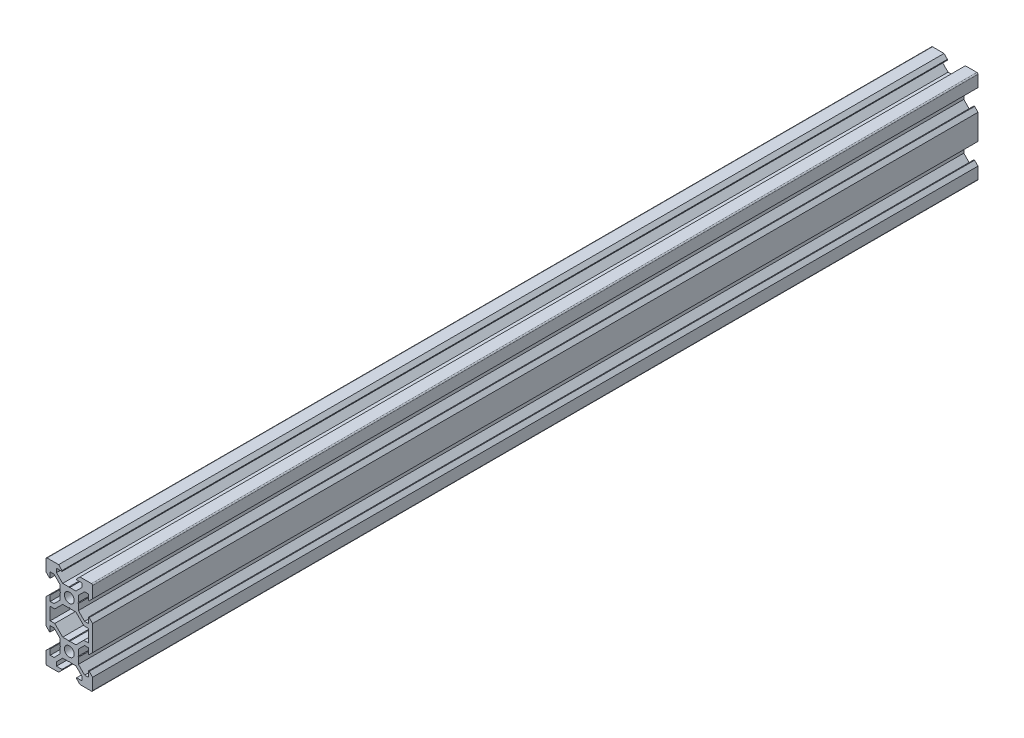
from build123d import *
from build123d.topology import SkipClean

# Parameters (mm, degrees)
BOSS_EXTRU_1_DEPTH     = 380
SYM_TRIE6_COPY_1_DEPTH = 380


with BuildPart() as part:
    # Esquisse1 → Boss.-Extru.1 (new body)
    with BuildSketch(Plane.XY):
        with BuildLine():
            Line((-9.5, 10), (-4.58, 10))
            Line((-4.58, 10), (-3.125, 8.545))
            Line((-3.125, 8.545), (-3.125, 8.2))
            Line((-3.125, 8.2), (-5.5, 8.2))
            Line((-5.5, 8.2), (-5.5, 6.560660172))
            Line((-5.5, 6.560660172), (-2.839339828, 3.9))
            Line((-2.839339828, 3.9), (-0.21, 3.9))
            Line((-0.21, 3.9), (0, 3.69))
            Line((0, 3.69), (0, 2.1))
            ThreePointArc((0, 2.1), (-2.1, 0), (0, -2.1))
            Line((0, -2.1), (0, -3.69))
            Line((0, -3.69), (-0.21, -3.9))
            Line((-0.21, -3.9), (-2.839339828, -3.9))
            Line((-2.839339828, -3.9), (-6.239339828, -7.3))
            Line((-6.239339828, -7.3), (-8.2, -7.3))
            Line((-8.2, -7.3), (-8.2, -10))
            Line((-8.2, -10), (-10, -10))
            Line((-10, -10), (-10, -4.58))
            Line((-10, -4.58), (-8.545, -3.125))
            Line((-8.545, -3.125), (-8.2, -3.125))
            Line((-8.2, -3.125), (-8.2, -5.5))
            Line((-8.2, -5.5), (-6.560660172, -5.5))
            Line((-6.560660172, -5.5), (-3.9, -2.839339828))
            Line((-3.9, -2.839339828), (-3.9, -0.21))
            Line((-3.9, -0.21), (-3.69, 0))
            Line((-3.69, 0), (-3.9, 0.21))
            Line((-3.9, 0.21), (-3.9, 2.839339828))
            Line((-3.9, 2.839339828), (-6.560660172, 5.5))
            Line((-6.560660172, 5.5), (-8.2, 5.5))
            Line((-8.2, 5.5), (-8.2, 3.125))
            Line((-8.2, 3.125), (-8.545, 3.125))
            Line((-8.545, 3.125), (-10, 4.58))
            Line((-10, 4.58), (-10, 9.5))
            ThreePointArc((-10, 9.5), (-9.853553391, 9.853553391), (-9.5, 10))
        make_face()
    boss_extru_1 = extrude(amount=BOSS_EXTRU_1_DEPTH)

    # Symétrie1: Boss.-Extru.1 across plane
    add(boss_extru_1.mirror(Plane(origin=(0, 3.69, 380), x_dir=(0, 0, 1), z_dir=(-1, 0, 0))))

    # Symétrie6: Boss.-Extru.1 across plane
    add(boss_extru_1.mirror(Plane(origin=(-8.2, -10, 380), x_dir=(0, 0, 1), z_dir=(0, 1, 0))))

    # Symétrie6 copy 1 sketch → Symétrie6 copy 1 (add)
    with SkipClean():  # the faces are left unmerged after this step: merging them gives an invalid solid
        with BuildSketch(Plane(origin=(0, -20, 0), x_dir=(-1, 0, 0), z_dir=(0, 0, 1))):
            with BuildLine():
                Line((-9.5, 10), (-4.58, 10))
                Line((-4.58, 10), (-3.125, 8.545))
                Line((-3.125, 8.545), (-3.125, 8.2))
                Line((-3.125, 8.2), (-5.5, 8.2))
                Line((-5.5, 8.2), (-5.5, 6.560660172))
                Line((-5.5, 6.560660172), (-2.839339828, 3.9))
                Line((-2.839339828, 3.9), (-0.21, 3.9))
                Line((-0.21, 3.9), (0, 3.69))
                Line((0, 3.69), (0, 2.1))
                ThreePointArc((0, 2.1), (-2.1, 0), (0, -2.1))
                Line((0, -2.1), (0, -3.69))
                Line((0, -3.69), (-0.21, -3.9))
                Line((-0.21, -3.9), (-2.839339828, -3.9))
                Line((-2.839339828, -3.9), (-6.239339828, -7.3))
                Line((-6.239339828, -7.3), (-8.2, -7.3))
                Line((-8.2, -7.3), (-8.2, -10))
                Line((-8.2, -10), (-10, -10))
                Line((-10, -10), (-10, -4.58))
                Line((-10, -4.58), (-8.545, -3.125))
                Line((-8.545, -3.125), (-8.2, -3.125))
                Line((-8.2, -3.125), (-8.2, -5.5))
                Line((-8.2, -5.5), (-6.560660172, -5.5))
                Line((-6.560660172, -5.5), (-3.9, -2.839339828))
                Line((-3.9, -2.839339828), (-3.9, -0.21))
                Line((-3.9, -0.21), (-3.69, 0))
                Line((-3.69, 0), (-3.9, 0.21))
                Line((-3.9, 0.21), (-3.9, 2.839339828))
                Line((-3.9, 2.839339828), (-6.560660172, 5.5))
                Line((-6.560660172, 5.5), (-8.2, 5.5))
                Line((-8.2, 5.5), (-8.2, 3.125))
                Line((-8.2, 3.125), (-8.545, 3.125))
                Line((-8.545, 3.125), (-10, 4.58))
                Line((-10, 4.58), (-10, 9.5))
                ThreePointArc((-10, 9.5), (-9.853553391, 9.853553391), (-9.5, 10))
            make_face()
        extrude(amount=SYM_TRIE6_COPY_1_DEPTH)


solid = part.part
